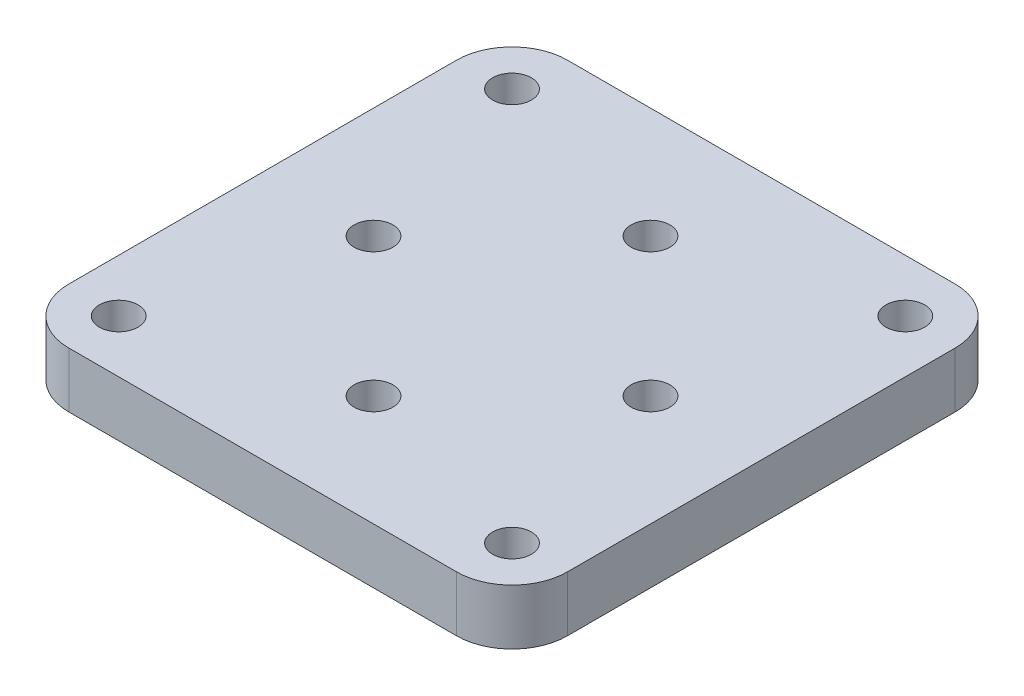
from build123d import *

# Parameters (mm, degrees)
SKETCH1_W            = 90
SKETCH1_H            = 90
BOSS_EXTRUDE1_DEPTH  = 10
M6_CLEARANCE_HOLE1_D = 7
M6_CLEARANCE_HOLE2_D = 7
FILLET1_R            = 10


with BuildPart() as part:
    # Sketch1 → Boss-Extrude1 (new body)
    with BuildSketch(Plane(origin=(0, 0, 0), x_dir=(1, 0, 0), z_dir=(0, 1, 0))):
        Rectangle(SKETCH1_W, SKETCH1_H)
    extrude(amount=BOSS_EXTRUDE1_DEPTH)

    # M6 Clearance Hole1 (through all)
    with Locations(Plane(origin=(0, 10, 0), x_dir=(1, 0, 0), z_dir=(0, 1, 0))):
        with Locations((-25, 0), (0, 25), (25, 0), (0, -25)):
            Hole(M6_CLEARANCE_HOLE1_D / 2)

    # M6 Clearance Hole2 (through all)
    with Locations(Plane(origin=(-35.5, 10, -35.5), x_dir=(0, 0, 1), z_dir=(0, 1, 0))):
        with Locations((0, 0), (71, 0), (0, 71), (71, 71)):
            Hole(M6_CLEARANCE_HOLE2_D / 2)

    # Fillet1
    fillet1_edges = [part.edges().sort_by_distance(p)[0] for p in [
        (45, 5, 45),
        (-45, 5, 45),
        (-45, 5, -45),
        (45, 5, -45),
    ]]
    fillet(fillet1_edges, radius=FILLET1_R)


solid = part.part
